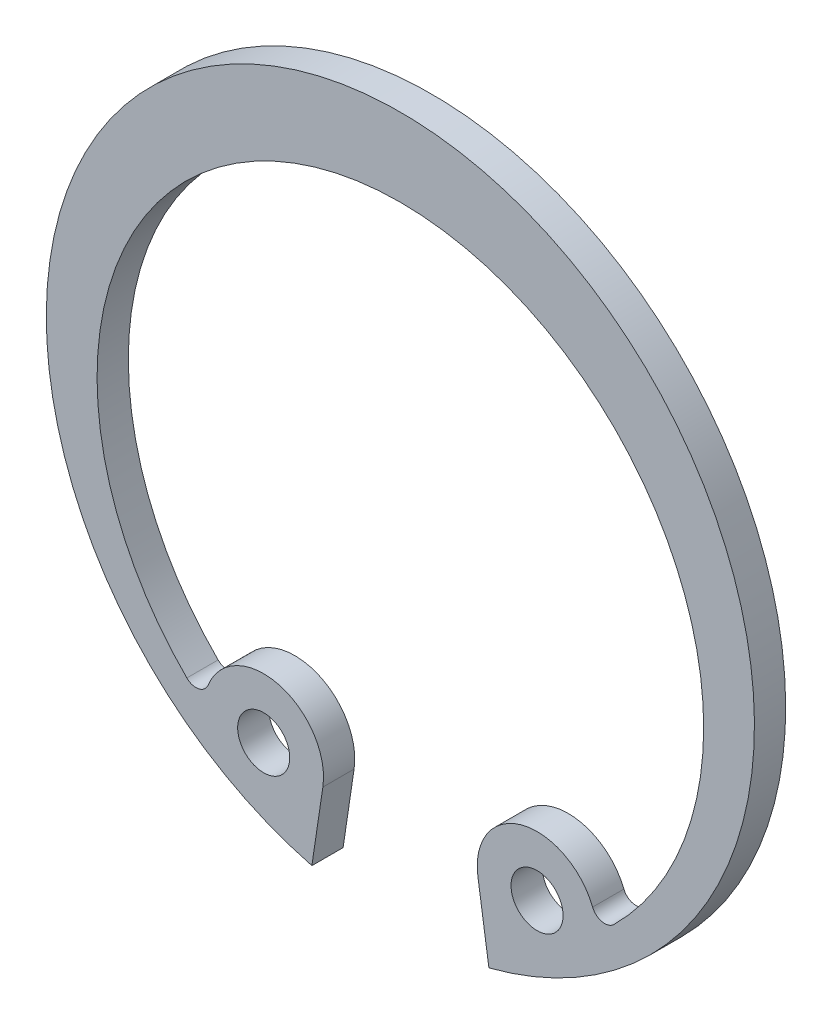
from build123d import *

# Parameters (mm, degrees)
SKETCH1_R           = 1
BOSS_EXTRUDE1_DEPTH = 1.2


with BuildPart() as part:
    # Sketch1 → Boss-Extrude1 (new body)
    with BuildSketch(Plane.XY):
        with BuildLine():
            Line((-2.97779023, -10.343071844), (-3.4, -13.168143377))
            ThreePointArc((-3.4, -13.168143377), (0, 13.6), (3.4, -13.168143377))
            Line((3.4, -13.168143377), (2.97779023, -10.343071844))
            ThreePointArc((2.97779023, -10.343071844), (4.651501232, -7.785368396), (7.384628177, -9.154007336))
            ThreePointArc((7.384628177, -9.154007336), (7.747142587, -9.458607079), (8.201175593, -9.324250352))
            ThreePointArc((8.201175593, -9.324250352), (0, 10.6), (-8.201175593, -9.324250352))
            ThreePointArc((-8.201175593, -9.324250352), (-7.747142587, -9.458607079), (-7.384628177, -9.154007336))
            ThreePointArc((-7.384628177, -9.154007336), (-4.651501232, -7.785368396), (-2.97779023, -10.343071844))
        make_face()
        with Locations((-5.25, -10.003487819)):
            Circle(SKETCH1_R, mode=Mode.SUBTRACT)
        with Locations((5.25, -10.003487819)):
            Circle(SKETCH1_R, mode=Mode.SUBTRACT)
    extrude(amount=BOSS_EXTRUDE1_DEPTH)


solid = part.part
